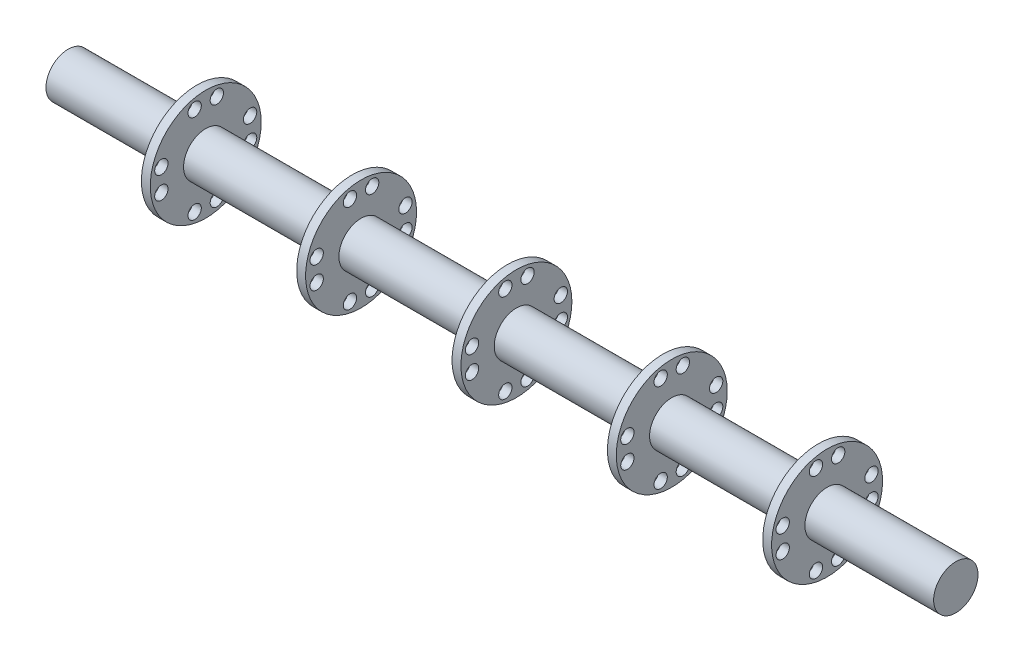
from build123d import *

# Parameters (mm, degrees)
SKETCH_1_R               = 5
EXTRUDE_1_DEPTH          = 100
SKETCH_2_R               = 12.5
EXTRUDE_2_DEPTH          = 1
PATTERN_LINEAR_1_COUNT   = 3
PATTERN_LINEAR_1_PITCH   = 35
PATTERN_LINEAR_2_COUNT   = 3
PATTERN_LINEAR_2_PITCH   = 35
SKETCH_3_R               = 1.5
CUT_EXTRUDE_1_DEPTH      = 499.5
PATTERN_CIRCULAR_1_COUNT = 4


with BuildPart() as part:
    # 草图1 → 凸台-拉伸1 (new, symmetric)
    with BuildSketch(Plane(origin=(0, 0, 0), x_dir=(0, 0, -1), z_dir=(1, 0, 0))):
        Circle(SKETCH_1_R)
    extrude(amount=EXTRUDE_1_DEPTH, both=True)

    # 草图2 → 凸台-拉伸2 (add, symmetric)
    with BuildSketch(Plane(origin=(0, 0, 0), x_dir=(0, 0, -1), z_dir=(1, 0, 0))):
        Circle(SKETCH_2_R)
    extrude_2 = extrude(amount=EXTRUDE_2_DEPTH, both=True)

    # 阵列(线性)1: 凸台-拉伸2 ×3
    with Locations(*[(-i * PATTERN_LINEAR_1_PITCH, 0, 0) for i in range(1, PATTERN_LINEAR_1_COUNT)]):
        add(extrude_2)

    # 阵列(线性)2: 凸台-拉伸2 ×3
    with Locations(*[(i * PATTERN_LINEAR_2_PITCH, 0, 0) for i in range(1, PATTERN_LINEAR_2_COUNT)]):
        add(extrude_2)

    # 草图3 → 切除-拉伸1 (cut, symmetric)
    with BuildSketch(Plane(origin=(1, 0, 0), x_dir=(0, 0, -1), z_dir=(1, 0, 0))):
        with Locations((2.5, 10)):
            Circle(SKETCH_3_R)
        with Locations((-2.5, 10)):
            Circle(SKETCH_3_R)
    cut_extrude_1 = extrude(amount=CUT_EXTRUDE_1_DEPTH, both=True, mode=Mode.SUBTRACT)

    # 阵列(圆周)1: 切除-拉伸1 ×4 about axis
    pattern_circular_1_axis = Axis((0, 0, 0), (1, 0, 0))
    for i in range(1, PATTERN_CIRCULAR_1_COUNT):
        add(cut_extrude_1.rotate(pattern_circular_1_axis, i * 360 / PATTERN_CIRCULAR_1_COUNT), mode=Mode.SUBTRACT)


solid = part.part
